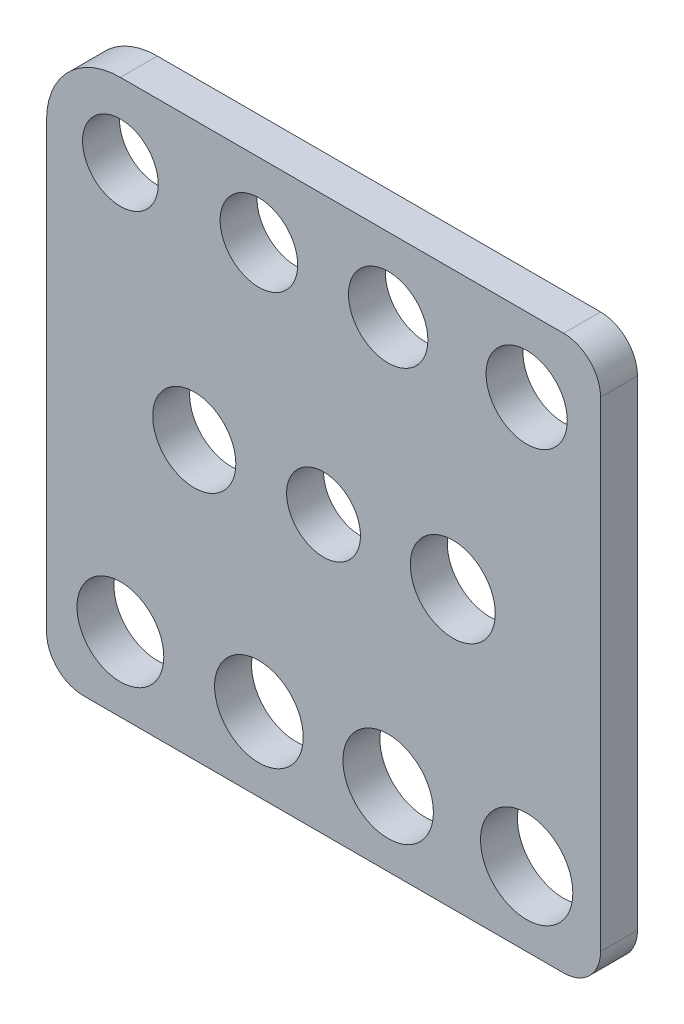
from build123d import *

# Parameters (mm, degrees)
CROQUIS1_R              = 2.2
CROQUIS1_R_2            = 2.5
CROQUIS1_R_3            = 2.35
CROQUIS1_R_4            = 2.05
CROQUIS1_R_5            = 2.1
CROQUIS1_R_6            = 2.15
CROQUIS1_R_7            = 2.4
CROQUIS1_R_8            = 2.45
CROQUIS1_R_9            = 2.25
CROQUIS1_R_10           = 2.3
CROQUIS1_R_11           = 2
SALIENTE_EXTRUIR1_DEPTH = 2


with BuildPart() as part:
    # Croquis1 → Saliente-Extruir1 (new body)
    with BuildSketch(Plane.XY):
        with BuildLine():
            Line((-84.957262486, 47.717592446), (-60.957262486, 47.717592446))
            ThreePointArc((-60.957262486, 47.717592446), (-59.543048923, 47.131806009), (-58.957262486, 45.717592446))
            Line((-58.957262486, 45.717592446), (-58.957262486, 19.717592446))
            ThreePointArc((-58.957262486, 19.717592446), (-59.543048923, 18.303378884), (-60.957262486, 17.717592446))
            Line((-60.957262486, 17.717592446), (-86.957262486, 17.717592446))
            ThreePointArc((-86.957262486, 17.717592446), (-88.371476048, 18.303378884), (-88.957262486, 19.717592446))
            Line((-88.957262486, 19.717592446), (-88.957262486, 43.717592446))
            ThreePointArc((-88.957262486, 43.717592446), (-87.78568961, 46.546019571), (-84.957262486, 47.717592446))
        make_face()
        with Locations((-62.957262486, 43.717592446)):
            Circle(CROQUIS1_R, mode=Mode.SUBTRACT)
        with Locations((-62.957262486, 21.717592446)):
            Circle(CROQUIS1_R_2, mode=Mode.SUBTRACT)
        with Locations((-84.957262486, 21.717592446)):
            Circle(CROQUIS1_R_3, mode=Mode.SUBTRACT)
        with Locations((-84.957262486, 43.717592446)):
            Circle(CROQUIS1_R_4, mode=Mode.SUBTRACT)
        with Locations((-77.457263515, 43.721521604)):
            Circle(CROQUIS1_R_5, mode=Mode.SUBTRACT)
        with Locations((-70.457261138, 43.722088276)):
            Circle(CROQUIS1_R_6, mode=Mode.SUBTRACT)
        with Locations((-77.457263515, 21.721521604)):
            Circle(CROQUIS1_R_7, mode=Mode.SUBTRACT)
        with Locations((-70.457261138, 21.722088276)):
            Circle(CROQUIS1_R_8, mode=Mode.SUBTRACT)
        with Locations((-80.957262486, 32.717592446)):
            Circle(CROQUIS1_R_9, mode=Mode.SUBTRACT)
        with Locations((-66.957262486, 32.717592446)):
            Circle(CROQUIS1_R_10, mode=Mode.SUBTRACT)
        with Locations((-73.957262486, 32.717592446)):
            Circle(CROQUIS1_R_11, mode=Mode.SUBTRACT)
    extrude(amount=SALIENTE_EXTRUIR1_DEPTH)


solid = part.part
